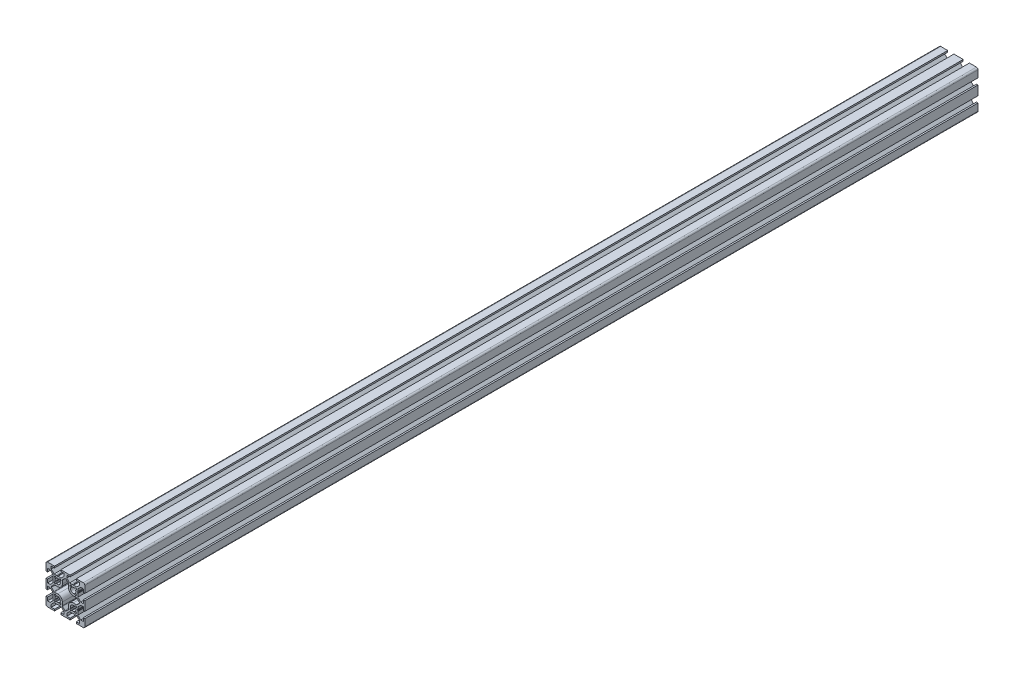
from build123d import *

# Parameters (mm, degrees)
BOSS_EXTRUDE1_DEPTH = 1150
CUT_EXTRUDE1_DEPTH  = 1151.5433499
CUT_EXTRUDE2_DEPTH  = 1151.5433499
CUT_EXTRUDE3_DEPTH  = 1151.5433499
CUT_EXTRUDE4_DEPTH  = 1151.5433499


with BuildPart() as part:
    # Sketch1 → Boss-Extrude1 (new body)
    with BuildSketch(Plane.XY):
        with BuildLine():
            Line((-25, 23), (-25, 14))
            Line((-25, 14), (-23, 14))
            Line((-23, 14), (-23, 18.25))
            Line((-23, 18.25), (-19.664213562, 18.25))
            Line((-19.664213562, 18.25), (-16, 14.585786438))
            Line((-16, 14.585786438), (-16, 10.653589838))
            ThreePointArc((-16, 10.653589838), (-15.982962913, 10.524180316), (-15.933012702, 10.403589838))
            Line((-15.933012702, 10.403589838), (-15.7, 10))
            Line((-15.7, 10), (-15.933012702, 9.596410162))
            ThreePointArc((-15.933012702, 9.596410162), (-16, 9.346410162), (-15.933012702, 9.096410162))
            Line((-15.933012702, 9.096410162), (-15.750976592, 8.781114371))
            Line((-15.750976592, 8.781114371), (-16, 7.5))
            Line((-16, 7.5), (-16, 5.414213562))
            Line((-16, 5.414213562), (-19.664213562, 1.75))
            Line((-19.664213562, 1.75), (-23, 1.75))
            Line((-23, 1.75), (-23, 6))
            Line((-23, 6), (-25, 6))
            Line((-25, 6), (-25, -6))
            Line((-25, -6), (-23, -6))
            Line((-23, -6), (-23, -1.75))
            Line((-23, -1.75), (-19.664213562, -1.75))
            Line((-19.664213562, -1.75), (-16, -5.414213562))
            Line((-16, -5.414213562), (-16, -9.346410162))
            ThreePointArc((-16, -9.346410162), (-15.982962913, -9.475819684), (-15.933012702, -9.596410162))
            Line((-15.933012702, -9.596410162), (-15.7, -10))
            Line((-15.7, -10), (-15.933012702, -10.403589838))
            ThreePointArc((-15.933012702, -10.403589838), (-16, -10.653589838), (-15.933012702, -10.903589838))
            Line((-15.933012702, -10.903589838), (-15.750976592, -11.218885629))
            Line((-15.750976592, -11.218885629), (-16, -12.5))
            Line((-16, -12.5), (-16, -14.585786438))
            Line((-16, -14.585786438), (-19.664213562, -18.25))
            Line((-19.664213562, -18.25), (-23, -18.25))
            Line((-23, -18.25), (-23, -14))
            Line((-23, -14), (-25, -14))
            Line((-25, -14), (-25, -23))
            ThreePointArc((-25, -23), (-24.414213562, -24.414213562), (-23, -25))
            Line((-23, -25), (-14, -25))
            Line((-14, -25), (-14, -23))
            Line((-14, -23), (-18.25, -23))
            Line((-18.25, -23), (-18.25, -19.664213562))
            Line((-18.25, -19.664213562), (-14.585786438, -16))
            Line((-14.585786438, -16), (-10.653589838, -16))
            ThreePointArc((-10.653589838, -16), (-10.524180316, -15.982962913), (-10.403589838, -15.933012702))
            Line((-10.403589838, -15.933012702), (-10, -15.7))
            Line((-10, -15.7), (-9.596410162, -15.933012702))
            ThreePointArc((-9.596410162, -15.933012702), (-9.346410162, -16), (-9.096410162, -15.933012702))
            Line((-9.096410162, -15.933012702), (-8.781114371, -15.750976592))
            Line((-8.781114371, -15.750976592), (-7.5, -16))
            Line((-7.5, -16), (-5.414213562, -16))
            Line((-5.414213562, -16), (-1.75, -19.664213562))
            Line((-1.75, -19.664213562), (-1.75, -23))
            Line((-1.75, -23), (-6, -23))
            Line((-6, -23), (-6, -25))
            Line((-6, -25), (6, -25))
            Line((6, -25), (6, -23))
            Line((6, -23), (1.75, -23))
            Line((1.75, -23), (1.75, -19.664213562))
            Line((1.75, -19.664213562), (5.414213562, -16))
            Line((5.414213562, -16), (9.346410162, -16))
            ThreePointArc((9.346410162, -16), (9.475819684, -15.982962913), (9.596410162, -15.933012702))
            Line((9.596410162, -15.933012702), (10, -15.7))
            Line((10, -15.7), (10.403589838, -15.933012702))
            ThreePointArc((10.403589838, -15.933012702), (10.653589838, -16), (10.903589838, -15.933012702))
            Line((10.903589838, -15.933012702), (11.218885629, -15.750976592))
            Line((11.218885629, -15.750976592), (12.5, -16))
            Line((12.5, -16), (14.585786438, -16))
            Line((14.585786438, -16), (18.25, -19.664213562))
            Line((18.25, -19.664213562), (18.25, -23))
            Line((18.25, -23), (14, -23))
            Line((14, -23), (14, -25))
            Line((14, -25), (23, -25))
            ThreePointArc((23, -25), (24.414213562, -24.414213562), (25, -23))
            Line((25, -23), (25, -14))
            Line((25, -14), (23, -14))
            Line((23, -14), (23, -18.25))
            Line((23, -18.25), (19.664213562, -18.25))
            Line((19.664213562, -18.25), (16, -14.585786438))
            Line((16, -14.585786438), (16, -10.653589838))
            ThreePointArc((16, -10.653589838), (15.982962913, -10.524180316), (15.933012702, -10.403589838))
            Line((15.933012702, -10.403589838), (15.7, -10))
            Line((15.7, -10), (15.933012702, -9.596410162))
            ThreePointArc((15.933012702, -9.596410162), (16, -9.346410162), (15.933012702, -9.096410162))
            Line((15.933012702, -9.096410162), (15.750976592, -8.781114371))
            Line((15.750976592, -8.781114371), (16, -7.5))
            Line((16, -7.5), (16, -5.414213562))
            Line((16, -5.414213562), (19.664213562, -1.75))
            Line((19.664213562, -1.75), (23, -1.75))
            Line((23, -1.75), (23, -6))
            Line((23, -6), (25, -6))
            Line((25, -6), (25, 6))
            Line((25, 6), (23, 6))
            Line((23, 6), (23, 1.75))
            Line((23, 1.75), (19.664213562, 1.75))
            Line((19.664213562, 1.75), (16, 5.414213562))
            Line((16, 5.414213562), (16, 9.346410162))
            ThreePointArc((16, 9.346410162), (15.982962913, 9.475819684), (15.933012702, 9.596410162))
            Line((15.933012702, 9.596410162), (15.7, 10))
            Line((15.7, 10), (15.933012702, 10.403589838))
            ThreePointArc((15.933012702, 10.403589838), (16, 10.653589838), (15.933012702, 10.903589838))
            Line((15.933012702, 10.903589838), (15.750976592, 11.218885629))
            Line((15.750976592, 11.218885629), (16, 12.5))
            Line((16, 12.5), (16, 14.585786438))
            Line((16, 14.585786438), (19.664213562, 18.25))
            Line((19.664213562, 18.25), (23, 18.25))
            Line((23, 18.25), (23, 14))
            Line((23, 14), (25, 14))
            Line((25, 14), (25, 23))
            ThreePointArc((25, 23), (24.414213562, 24.414213562), (23, 25))
            Line((23, 25), (14, 25))
            Line((14, 25), (14, 23))
            Line((14, 23), (18.25, 23))
            Line((18.25, 23), (18.25, 19.664213562))
            Line((18.25, 19.664213562), (14.585786438, 16))
            Line((14.585786438, 16), (10.653589838, 16))
            ThreePointArc((10.653589838, 16), (10.524180316, 15.982962913), (10.403589838, 15.933012702))
            Line((10.403589838, 15.933012702), (10, 15.7))
            Line((10, 15.7), (9.596410162, 15.933012702))
            ThreePointArc((9.596410162, 15.933012702), (9.346410162, 16), (9.096410162, 15.933012702))
            Line((9.096410162, 15.933012702), (8.781114371, 15.750976592))
            Line((8.781114371, 15.750976592), (7.5, 16))
            Line((7.5, 16), (5.414213562, 16))
            Line((5.414213562, 16), (1.75, 19.664213562))
            Line((1.75, 19.664213562), (1.75, 23))
            Line((1.75, 23), (6, 23))
            Line((6, 23), (6, 25))
            Line((6, 25), (-6, 25))
            Line((-6, 25), (-6, 23))
            Line((-6, 23), (-1.75, 23))
            Line((-1.75, 23), (-1.75, 19.664213562))
            Line((-1.75, 19.664213562), (-5.414213562, 16))
            Line((-5.414213562, 16), (-9.346410162, 16))
            ThreePointArc((-9.346410162, 16), (-9.475819684, 15.982962913), (-9.596410162, 15.933012702))
            Line((-9.596410162, 15.933012702), (-10, 15.7))
            Line((-10, 15.7), (-10.403589838, 15.933012702))
            ThreePointArc((-10.403589838, 15.933012702), (-10.653589838, 16), (-10.903589838, 15.933012702))
            Line((-10.903589838, 15.933012702), (-11.218885629, 15.750976592))
            Line((-11.218885629, 15.750976592), (-12.5, 16))
            Line((-12.5, 16), (-14.585786438, 16))
            Line((-14.585786438, 16), (-18.25, 19.664213562))
            Line((-18.25, 19.664213562), (-18.25, 23))
            Line((-18.25, 23), (-14, 23))
            Line((-14, 23), (-14, 25))
            Line((-14, 25), (-23, 25))
            ThreePointArc((-23, 25), (-24.414213562, 24.414213562), (-25, 23))
        make_face()
        with BuildLine():
            Line((-17.878679656, -0.707106781), (-14.878679656, -3.707106781))
            ThreePointArc((-14.878679656, -3.707106781), (-14.554256308, -3.923879533), (-14.171572875, -4))
            Line((-14.171572875, -4), (-10, -4))
            ThreePointArc((-10, -4), (-5.757359313, -5.757359313), (-4, -10))
            Line((-4, -10), (-4, -14.171572875))
            ThreePointArc((-4, -14.171572875), (-3.923879533, -14.554256308), (-3.707106781, -14.878679656))
            Line((-3.707106781, -14.878679656), (-0.707106781, -17.878679656))
            ThreePointArc((-0.707106781, -17.878679656), (0, -18.171572875), (0.707106781, -17.878679656))
            Line((0.707106781, -17.878679656), (3.707106781, -14.878679656))
            ThreePointArc((3.707106781, -14.878679656), (3.923879533, -14.554256308), (4, -14.171572875))
            Line((4, -14.171572875), (4, -10))
            ThreePointArc((4, -10), (5.757359313, -5.757359313), (10, -4))
            Line((10, -4), (14.171572875, -4))
            ThreePointArc((14.171572875, -4), (14.554256308, -3.923879533), (14.878679656, -3.707106781))
            Line((14.878679656, -3.707106781), (17.878679656, -0.707106781))
            ThreePointArc((17.878679656, -0.707106781), (18.171572875, 0), (17.878679656, 0.707106781))
            Line((17.878679656, 0.707106781), (14.878679656, 3.707106781))
            ThreePointArc((14.878679656, 3.707106781), (14.554256308, 3.923879533), (14.171572875, 4))
            Line((14.171572875, 4), (10, 4))
            ThreePointArc((10, 4), (5.757359313, 5.757359313), (4, 10))
            Line((4, 10), (4, 14.171572875))
            ThreePointArc((4, 14.171572875), (3.923879533, 14.554256308), (3.707106781, 14.878679656))
            Line((3.707106781, 14.878679656), (0.707106781, 17.878679656))
            ThreePointArc((0.707106781, 17.878679656), (0, 18.171572875), (-0.707106781, 17.878679656))
            Line((-0.707106781, 17.878679656), (-3.707106781, 14.878679656))
            ThreePointArc((-3.707106781, 14.878679656), (-3.923879533, 14.554256308), (-4, 14.171572875))
            Line((-4, 14.171572875), (-4, 10))
            ThreePointArc((-4, 10), (-5.757359313, 5.757359313), (-10, 4))
            Line((-10, 4), (-14.171572875, 4))
            ThreePointArc((-14.171572875, 4), (-14.554256308, 3.923879533), (-14.878679656, 3.707106781))
            Line((-14.878679656, 3.707106781), (-17.878679656, 0.707106781))
            ThreePointArc((-17.878679656, 0.707106781), (-18.171572875, 0), (-17.878679656, -0.707106781))
        make_face(mode=Mode.SUBTRACT)
    extrude(amount=-BOSS_EXTRUDE1_DEPTH)

    # Sketch2 → Cut-Extrude1 (cut, through all)
    with BuildSketch(Plane.XY):
        with BuildLine():
            Line((-14.242640687, 12.828427125), (-13.205105981, 11.790892418))
            ThreePointArc((-13.205105981, 11.790892418), (-13.095045749, 11.583064884), (-13.120796199, 11.349307631))
            ThreePointArc((-13.120796199, 11.349307631), (-13.4, 10.000000021), (-13.120796216, 8.650692407))
            ThreePointArc((-13.120796216, 8.650692407), (-13.095045745, 8.416935137), (-13.205105981, 8.209107582))
            Line((-13.205105981, 8.209107582), (-14.242640687, 7.171572875))
            ThreePointArc((-14.242640687, 7.171572875), (-14.389087297, 6.818019485), (-14.242640687, 6.464466094))
            Line((-14.242640687, 6.464466094), (-13.535533906, 5.757359313))
            ThreePointArc((-13.535533906, 5.757359313), (-13.181980515, 5.610912703), (-12.828427125, 5.757359313))
            Line((-12.828427125, 5.757359313), (-11.790892418, 6.794894019))
            ThreePointArc((-11.790892418, 6.794894019), (-11.583064884, 6.904954251), (-11.349307631, 6.879203801))
            ThreePointArc((-11.349307631, 6.879203801), (-7.595836944, 7.595836944), (-6.879203801, 11.349307631))
            ThreePointArc((-6.879203801, 11.349307631), (-6.904954251, 11.583064884), (-6.794894019, 11.790892418))
            Line((-6.794894019, 11.790892418), (-5.757359313, 12.828427125))
            ThreePointArc((-5.757359313, 12.828427125), (-5.610912703, 13.181980515), (-5.757359313, 13.535533906))
            Line((-5.757359313, 13.535533906), (-6.464466094, 14.242640687))
            ThreePointArc((-6.464466094, 14.242640687), (-6.818019485, 14.389087297), (-7.171572875, 14.242640687))
            Line((-7.171572875, 14.242640687), (-8.209107582, 13.205105981))
            ThreePointArc((-8.209107582, 13.205105981), (-8.416935116, 13.095045749), (-8.650692369, 13.120796199))
            ThreePointArc((-8.650692369, 13.120796199), (-9.999999979, 13.4), (-11.349307593, 13.120796216))
            ThreePointArc((-11.349307593, 13.120796216), (-11.583064863, 13.095045745), (-11.790892418, 13.205105981))
            Line((-11.790892418, 13.205105981), (-12.828427125, 14.242640687))
            ThreePointArc((-12.828427125, 14.242640687), (-13.181980515, 14.389087297), (-13.535533906, 14.242640687))
            Line((-13.535533906, 14.242640687), (-14.242640687, 13.535533906))
            ThreePointArc((-14.242640687, 13.535533906), (-14.389087297, 13.181980515), (-14.242640687, 12.828427125))
        make_face()
    extrude(amount=-CUT_EXTRUDE1_DEPTH, mode=Mode.SUBTRACT)

    # Sketch3 → Cut-Extrude2 (cut, through all)
    with BuildSketch(Plane.XY):
        with BuildLine():
            Line((-12.828427125, -14.242640687), (-11.790892418, -13.205105981))
            ThreePointArc((-11.790892418, -13.205105981), (-11.583064884, -13.095045749), (-11.349307631, -13.120796199))
            ThreePointArc((-11.349307631, -13.120796199), (-10.000000021, -13.4), (-8.650692407, -13.120796216))
            ThreePointArc((-8.650692407, -13.120796216), (-8.416935137, -13.095045745), (-8.209107582, -13.205105981))
            Line((-8.209107582, -13.205105981), (-7.171572875, -14.242640687))
            ThreePointArc((-7.171572875, -14.242640687), (-6.818019485, -14.389087297), (-6.464466094, -14.242640687))
            Line((-6.464466094, -14.242640687), (-5.757359313, -13.535533906))
            ThreePointArc((-5.757359313, -13.535533906), (-5.610912703, -13.181980515), (-5.757359313, -12.828427125))
            Line((-5.757359313, -12.828427125), (-6.794894019, -11.790892418))
            ThreePointArc((-6.794894019, -11.790892418), (-6.904954251, -11.583064884), (-6.879203801, -11.349307631))
            ThreePointArc((-6.879203801, -11.349307631), (-7.595836944, -7.595836944), (-11.349307631, -6.879203801))
            ThreePointArc((-11.349307631, -6.879203801), (-11.583064884, -6.904954251), (-11.790892418, -6.794894019))
            Line((-11.790892418, -6.794894019), (-12.828427125, -5.757359313))
            ThreePointArc((-12.828427125, -5.757359313), (-13.181980515, -5.610912703), (-13.535533906, -5.757359313))
            Line((-13.535533906, -5.757359313), (-14.242640687, -6.464466094))
            ThreePointArc((-14.242640687, -6.464466094), (-14.389087297, -6.818019485), (-14.242640687, -7.171572875))
            Line((-14.242640687, -7.171572875), (-13.205105981, -8.209107582))
            ThreePointArc((-13.205105981, -8.209107582), (-13.095045749, -8.416935116), (-13.120796199, -8.650692369))
            ThreePointArc((-13.120796199, -8.650692369), (-13.4, -9.999999979), (-13.120796216, -11.349307593))
            ThreePointArc((-13.120796216, -11.349307593), (-13.095045745, -11.583064863), (-13.205105981, -11.790892418))
            Line((-13.205105981, -11.790892418), (-14.242640687, -12.828427125))
            ThreePointArc((-14.242640687, -12.828427125), (-14.389087297, -13.181980515), (-14.242640687, -13.535533906))
            Line((-14.242640687, -13.535533906), (-13.535533906, -14.242640687))
            ThreePointArc((-13.535533906, -14.242640687), (-13.181980515, -14.389087297), (-12.828427125, -14.242640687))
        make_face()
    extrude(amount=-CUT_EXTRUDE2_DEPTH, mode=Mode.SUBTRACT)

    # Sketch4 → Cut-Extrude3 (cut, through all)
    with BuildSketch(Plane.XY):
        with BuildLine():
            Line((14.242640687, -12.828427125), (13.205105981, -11.790892418))
            ThreePointArc((13.205105981, -11.790892418), (13.095045749, -11.583064884), (13.120796199, -11.349307631))
            ThreePointArc((13.120796199, -11.349307631), (13.4, -10.000000021), (13.120796216, -8.650692407))
            ThreePointArc((13.120796216, -8.650692407), (13.095045745, -8.416935137), (13.205105981, -8.209107582))
            Line((13.205105981, -8.209107582), (14.242640687, -7.171572875))
            ThreePointArc((14.242640687, -7.171572875), (14.389087297, -6.818019485), (14.242640687, -6.464466094))
            Line((14.242640687, -6.464466094), (13.535533906, -5.757359313))
            ThreePointArc((13.535533906, -5.757359313), (13.181980515, -5.610912703), (12.828427125, -5.757359313))
            Line((12.828427125, -5.757359313), (11.790892418, -6.794894019))
            ThreePointArc((11.790892418, -6.794894019), (11.583064884, -6.904954251), (11.349307631, -6.879203801))
            ThreePointArc((11.349307631, -6.879203801), (7.595836944, -7.595836944), (6.879203801, -11.349307631))
            ThreePointArc((6.879203801, -11.349307631), (6.904954251, -11.583064884), (6.794894019, -11.790892418))
            Line((6.794894019, -11.790892418), (5.757359313, -12.828427125))
            ThreePointArc((5.757359313, -12.828427125), (5.610912703, -13.181980515), (5.757359313, -13.535533906))
            Line((5.757359313, -13.535533906), (6.464466094, -14.242640687))
            ThreePointArc((6.464466094, -14.242640687), (6.818019485, -14.389087297), (7.171572875, -14.242640687))
            Line((7.171572875, -14.242640687), (8.209107582, -13.205105981))
            ThreePointArc((8.209107582, -13.205105981), (8.416935116, -13.095045749), (8.650692369, -13.120796199))
            ThreePointArc((8.650692369, -13.120796199), (9.999999979, -13.4), (11.349307593, -13.120796216))
            ThreePointArc((11.349307593, -13.120796216), (11.583064863, -13.095045745), (11.790892418, -13.205105981))
            Line((11.790892418, -13.205105981), (12.828427125, -14.242640687))
            ThreePointArc((12.828427125, -14.242640687), (13.181980515, -14.389087297), (13.535533906, -14.242640687))
            Line((13.535533906, -14.242640687), (14.242640687, -13.535533906))
            ThreePointArc((14.242640687, -13.535533906), (14.389087297, -13.181980515), (14.242640687, -12.828427125))
        make_face()
    extrude(amount=-CUT_EXTRUDE3_DEPTH, mode=Mode.SUBTRACT)

    # Sketch5 → Cut-Extrude4 (cut, through all)
    with BuildSketch(Plane.XY):
        with BuildLine():
            Line((12.828427125, 14.242640687), (11.790892418, 13.205105981))
            ThreePointArc((11.790892418, 13.205105981), (11.583064884, 13.095045749), (11.349307631, 13.120796199))
            ThreePointArc((11.349307631, 13.120796199), (10.000000021, 13.4), (8.650692407, 13.120796216))
            ThreePointArc((8.650692407, 13.120796216), (8.416935137, 13.095045745), (8.209107582, 13.205105981))
            Line((8.209107582, 13.205105981), (7.171572875, 14.242640687))
            ThreePointArc((7.171572875, 14.242640687), (6.818019485, 14.389087297), (6.464466094, 14.242640687))
            Line((6.464466094, 14.242640687), (5.757359313, 13.535533906))
            ThreePointArc((5.757359313, 13.535533906), (5.610912703, 13.181980515), (5.757359313, 12.828427125))
            Line((5.757359313, 12.828427125), (6.794894019, 11.790892418))
            ThreePointArc((6.794894019, 11.790892418), (6.904954251, 11.583064884), (6.879203801, 11.349307631))
            ThreePointArc((6.879203801, 11.349307631), (7.595836944, 7.595836944), (11.349307631, 6.879203801))
            ThreePointArc((11.349307631, 6.879203801), (11.583064884, 6.904954251), (11.790892418, 6.794894019))
            Line((11.790892418, 6.794894019), (12.828427125, 5.757359313))
            ThreePointArc((12.828427125, 5.757359313), (13.181980515, 5.610912703), (13.535533906, 5.757359313))
            Line((13.535533906, 5.757359313), (14.242640687, 6.464466094))
            ThreePointArc((14.242640687, 6.464466094), (14.389087297, 6.818019485), (14.242640687, 7.171572875))
            Line((14.242640687, 7.171572875), (13.205105981, 8.209107582))
            ThreePointArc((13.205105981, 8.209107582), (13.095045749, 8.416935116), (13.120796199, 8.650692369))
            ThreePointArc((13.120796199, 8.650692369), (13.4, 9.999999979), (13.120796216, 11.349307593))
            ThreePointArc((13.120796216, 11.349307593), (13.095045745, 11.583064863), (13.205105981, 11.790892418))
            Line((13.205105981, 11.790892418), (14.242640687, 12.828427125))
            ThreePointArc((14.242640687, 12.828427125), (14.389087297, 13.181980515), (14.242640687, 13.535533906))
            Line((14.242640687, 13.535533906), (13.535533906, 14.242640687))
            ThreePointArc((13.535533906, 14.242640687), (13.181980515, 14.389087297), (12.828427125, 14.242640687))
        make_face()
    extrude(amount=-CUT_EXTRUDE4_DEPTH, mode=Mode.SUBTRACT)


solid = part.part
